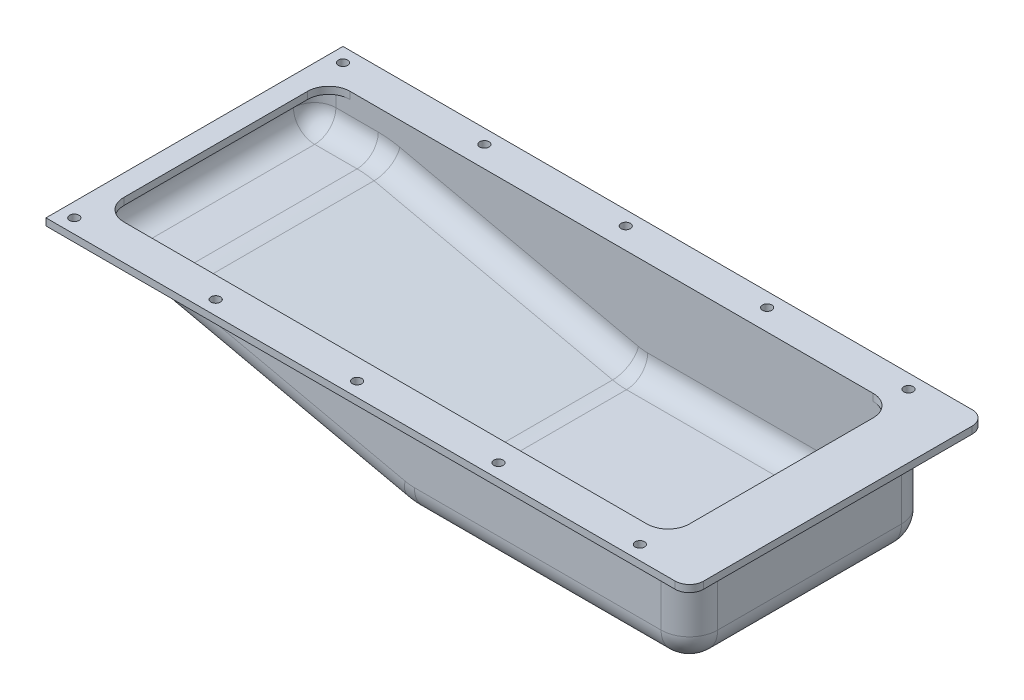
from build123d import *

# Parameters (mm, degrees)
BOSS_EXTRUDE2_DEPTH      = 85
BOSS_EXTRUDE2_DEPTH_BACK = 85
FILLET1_R                = 20
SHELL1_T                 = -5
BOSS_EXTRUDE3_DEPTH      = 5
M6_CLEARANCE_HOLE1_D     = 6.6
FILLET2_R                = 10


with BuildPart() as part:
    # Sketch4 → Boss-Extrude2 (new, two sides: drawn at the far end of the back side and taken through both)
    with BuildSketch(Plane.XY.offset(-BOSS_EXTRUDE2_DEPTH_BACK)):
        with BuildLine():
            Line((-245, 0), (-245, -10))
            ThreePointArc((-245, -10), (-239.142135624, -24.142135624), (-225, -30))
            Line((-225, -30), (-195, -30))
            ThreePointArc((-195, -30), (-189.529397686, -30.300175953), (-184.124481103, -31.197099587))
            Line((-184.124481103, -31.197099587), (-15.371875354, -68.802900413))
            ThreePointArc((-15.371875354, -68.802900413), (-9.966958771, -69.699824047), (-4.496356458, -70))
            Line((-4.496356458, -70), (170, -70))
            ThreePointArc((170, -70), (184.142135624, -64.142135624), (190, -50))
            Line((190, -50), (190, 0))
            Line((190, 0), (-245, 0))
        make_face()
    extrude(amount=BOSS_EXTRUDE2_DEPTH + BOSS_EXTRUDE2_DEPTH_BACK)

    # Fillet1
    fillet1_edges = [part.edges().sort_by_distance(p)[0] for p in [
        (-189.529397686, -30.300175953, -85),
        (-189.529397686, -30.300175953, 85),
        (190, -25, -85),
        (184.142135624, -64.142135624, -85),
        (82.751821771, -70, -85),
        (-99.748178229, -50, -85),
        (-210, -30, -85),
        (-239.142135624, -24.142135624, -85),
        (190, -25, 85),
        (184.142135624, -64.142135624, 85),
        (82.751821771, -70, 85),
        (-99.748178229, -50, 85),
        (-210, -30, 85),
        (-239.142135624, -24.142135624, 85),
        (-245, -5, -85),
        (-245, -5, 85),
        (-9.966958771, -69.699824047, -85),
        (-9.966958771, -69.699824047, 85),
    ]]
    fillet(fillet1_edges, radius=FILLET1_R)

    # Shell1
    shell1_openings = [part.faces().sort_by_distance(p)[0] for p in [
        (-27.5, 0, 0),
    ]]
    offset(amount=SHELL1_T, openings=shell1_openings, kind=Kind.INTERSECTION)

    # Sketch1 → Boss-Extrude3 (add)
    with BuildSketch(Plane(origin=(0, 0, 0), x_dir=(-1, 0, 0), z_dir=(0, 1, 0))):
        Polygon((-210, 35), (-210, -35), (-210, -105), (245, -105), (245, 105), (-210, 105), align=None)
        with BuildLine():
            Line((-170, 35), (-170, -35))
            Line((-170, -35), (-170, -65))
            ThreePointArc((-170, -65), (-165.606601718, -75.606601718), (-155, -80))
            Line((-155, -80), (215, -80))
            ThreePointArc((215, -80), (225.606601718, -75.606601718), (230, -65))
            Line((230, -65), (230, 65))
            ThreePointArc((230, 65), (225.606601718, 75.606601718), (215, 80))
            Line((215, 80), (-155, 80))
            ThreePointArc((-155, 80), (-165.606601718, 75.606601718), (-170, 65))
            Line((-170, 65), (-170, 35))
        make_face(mode=Mode.SUBTRACT)
    extrude(amount=BOSS_EXTRUDE3_DEPTH)

    # M6 Clearance Hole1 (through all)
    with Locations(Plane(origin=(0, 5, 0), x_dir=(1, 0, 0), z_dir=(0, 1, 0))):
        with Locations((165, -95), (65, -95), (-35, -95), (-135, -95), (-235, -95), (-235, 95), (-135, 95), (-35, 95), (65, 95), (165, 95)):
            Hole(M6_CLEARANCE_HOLE1_D / 2)

    # Fillet2
    fillet2_edges = [part.edges().sort_by_distance(p)[0] for p in [
        (210, 2.5, -105),
        (210, 2.5, 105),
    ]]
    fillet(fillet2_edges, radius=FILLET2_R)


solid = part.part
